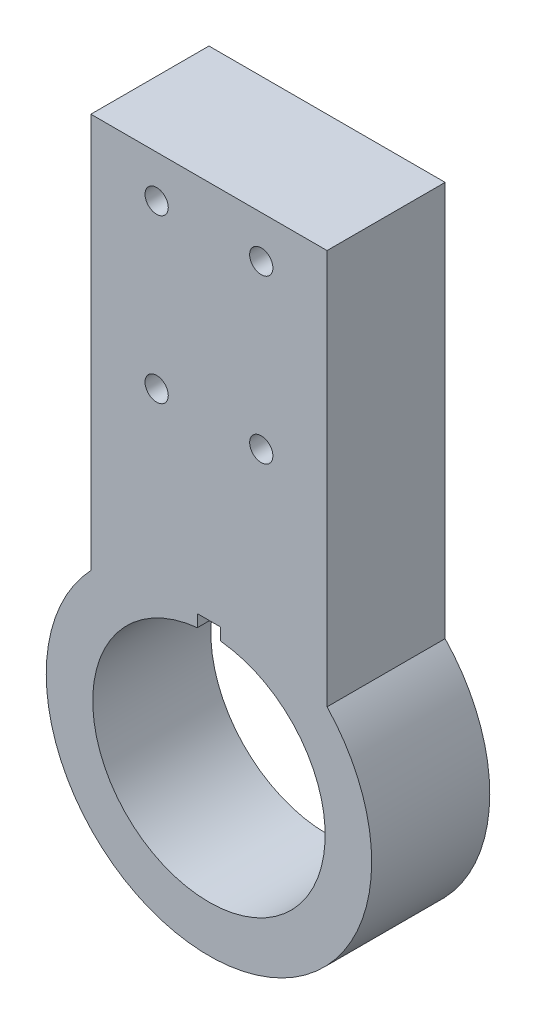
from build123d import *

# Parameters (mm, degrees)
SKETCH1_R           = 25
BOSS_EXTRUDE1_DEPTH = 25.4
SKETCH2_W           = 5
SKETCH2_H           = 27.5
CUT_EXTRUDE1_DEPTH  = 118.339581594
SKETCH3_R           = 2.5
CUT_EXTRUDE2_DEPTH  = 118.339581594


with BuildPart() as part:
    # Sketch1 → Boss-Extrude1 (new body)
    with BuildSketch(Plane.XY):
        with BuildLine():
            Line((-25.4, 24.079867109), (-25.4, 109.079867109))
            Line((-25.4, 109.079867109), (25.4, 109.079867109))
            Line((25.4, 109.079867109), (25.4, 24.079867109))
            ThreePointArc((25.4, 24.079867109), (0, -35), (-25.4, 24.079867109))
        make_face()
        Circle(SKETCH1_R, mode=Mode.SUBTRACT)
    extrude(amount=BOSS_EXTRUDE1_DEPTH)

    # Sketch2 → Cut-Extrude1 (cut, through all)
    with BuildSketch(Plane.XY.offset(25.4)):
        with Locations((0, 13.75)):
            Rectangle(SKETCH2_W, SKETCH2_H)
    extrude(amount=-CUT_EXTRUDE1_DEPTH, mode=Mode.SUBTRACT)

    # Sketch3 → Cut-Extrude2 (cut, through all)
    with BuildSketch(Plane.XY.offset(25.4)):
        with Locations((-11.25, 100)):
            Circle(SKETCH3_R)
        with Locations((11.25, 100)):
            Circle(SKETCH3_R)
        with Locations((11.25, 65)):
            Circle(SKETCH3_R)
        with Locations((-11.25, 65)):
            Circle(SKETCH3_R)
    extrude(amount=-CUT_EXTRUDE2_DEPTH, mode=Mode.SUBTRACT)


solid = part.part
